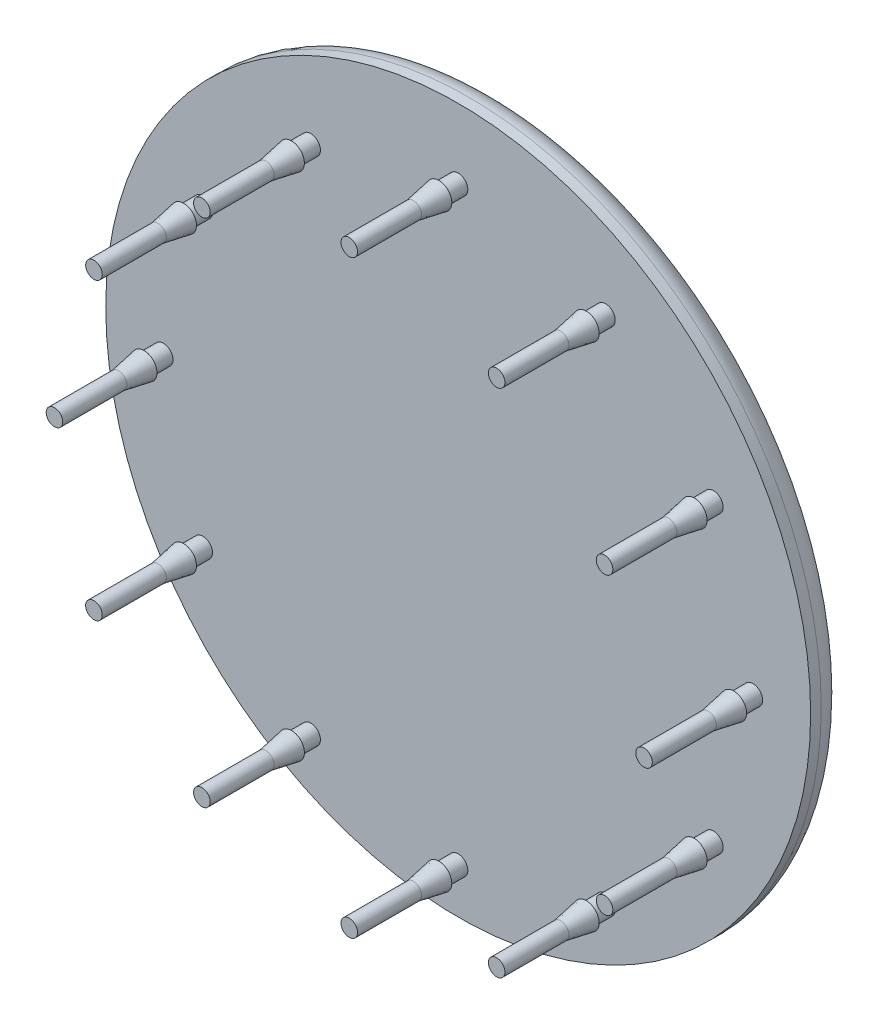
from build123d import *

# Parameters (mm, degrees)
SKETCH_1_R               = 55
SKETCH_1_R_2             = 48.5
EXTRUDE_1_DEPTH          = 1
SKETCH_4_R               = 1.5
EXTRUDE_2_DEPTH          = 3
SKETCH_5_R               = 2
EXTRUDE_3_DEPTH          = 4
EXTRUDE_3_TAPER          = 10
SKETCH_6_R               = 1.294692077
EXTRUDE_4_DEPTH          = 10
PATTERN_CIRCULAR_1_COUNT = 12
SKETCH_7_R               = 55
SKETCH_7_R_2             = 48.5
CUT_EXTRUDE_1_DEPTH      = 1
FILLET_1_R               = 4


with BuildPart() as part:
    # 草图1 → 凸台-拉伸1 (new body)
    with BuildSketch(Plane.XY):
        with Locations((0, 1.93)):
            Circle(SKETCH_1_R)
        Circle(SKETCH_1_R_2, mode=Mode.SUBTRACT)
    extrude(amount=-EXTRUDE_1_DEPTH)

    # 草图3 → 旋转2 (revolve)
    with BuildSketch(Plane(origin=(0, 0, 0), x_dir=(0, 0, -1), z_dir=(1, 0, 0)), mode=Mode.PRIVATE) as revolve_2_sk:
        with BuildLine():
            Line((1, 1.93), (1, 56.93))
            Line((1, 56.93), (6, 56.93))
            ThreePointArc((6, 56.93), (9.747427973, 29.543402543), (11, 1.93))
            Line((11, 1.93), (1, 1.93))
        make_face()
    revolve(revolve_2_sk.sketch.rotate(Axis((0, 1.93, -1), (0, 0, -1)), 90), axis=Axis((0, 1.93, -1), (0, 0, -1)))

    # 草图4 → 凸台-拉伸2 (add)
    with BuildSketch(Plane.XY.offset(-1)):
        with Locations(Location((0, -46, 0), (0, 0, 180))):
            Circle(SKETCH_4_R)
    extrude_2 = extrude(amount=EXTRUDE_2_DEPTH)

    # 草图5 → 凸台-拉伸3 (add)
    with BuildSketch(Plane.XY.offset(2)):
        with Locations((0, -46)):
            Circle(SKETCH_5_R)
    extrude_3 = extrude(amount=EXTRUDE_3_DEPTH, taper=EXTRUDE_3_TAPER)

    # 草图6 → 凸台-拉伸4 (add)
    with BuildSketch(Plane.XY.offset(6)):
        with Locations((0, -46)):
            Circle(SKETCH_6_R)
    extrude_4 = extrude(amount=EXTRUDE_4_DEPTH)

    # 阵列(圆周)1: 凸台-拉伸2, 凸台-拉伸3, 凸台-拉伸4 ×12 about axis
    pattern_circular_1_axis = Axis((0, 0, 0), (0, 0, 1))
    add([extrude_2.rotate(pattern_circular_1_axis, i * 360 / PATTERN_CIRCULAR_1_COUNT) for i in range(1, PATTERN_CIRCULAR_1_COUNT)])
    add([extrude_3.rotate(pattern_circular_1_axis, i * 360 / PATTERN_CIRCULAR_1_COUNT) for i in range(1, PATTERN_CIRCULAR_1_COUNT)])
    add([extrude_4.rotate(pattern_circular_1_axis, i * 360 / PATTERN_CIRCULAR_1_COUNT) for i in range(1, PATTERN_CIRCULAR_1_COUNT)])

    # 草图7 → 切除-拉伸1 (cut)
    with BuildSketch(Plane.XY):
        with Locations((0, 1.93)):
            Circle(SKETCH_7_R)
        Circle(SKETCH_7_R_2, mode=Mode.SUBTRACT)
    extrude(amount=-CUT_EXTRUDE_1_DEPTH, mode=Mode.SUBTRACT)

    # 圆角1
    fillet_1_edges = [part.edges().sort_by_distance(p)[0] for p in [
        (-55, 1.93, -6),
    ]]
    fillet(fillet_1_edges, radius=FILLET_1_R)


solid = part.part
